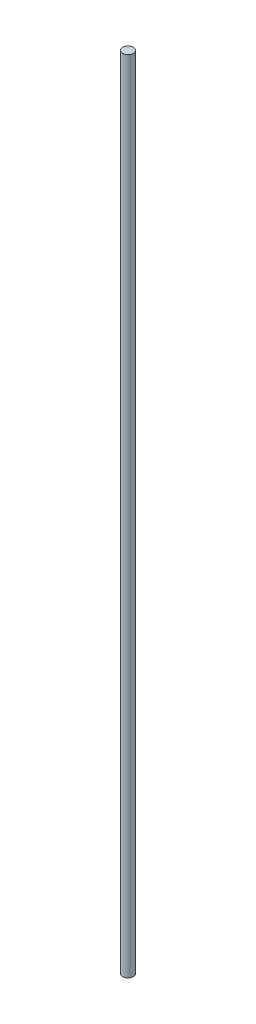
from build123d import *

# Parameters (mm, degrees)
SKETCH1_R           = 5
BOSS_EXTRUDE1_DEPTH = 750


with BuildPart() as part:
    # Sketch1 → Boss-Extrude1 (new body)
    with BuildSketch(Plane(origin=(0, 0, 0), x_dir=(1, 0, 0), z_dir=(0, 1, 0))):
        with Locations(Location((0, 0, 0), (0, 0, 270))):
            Circle(SKETCH1_R)
    extrude(amount=BOSS_EXTRUDE1_DEPTH)


solid = part.part
